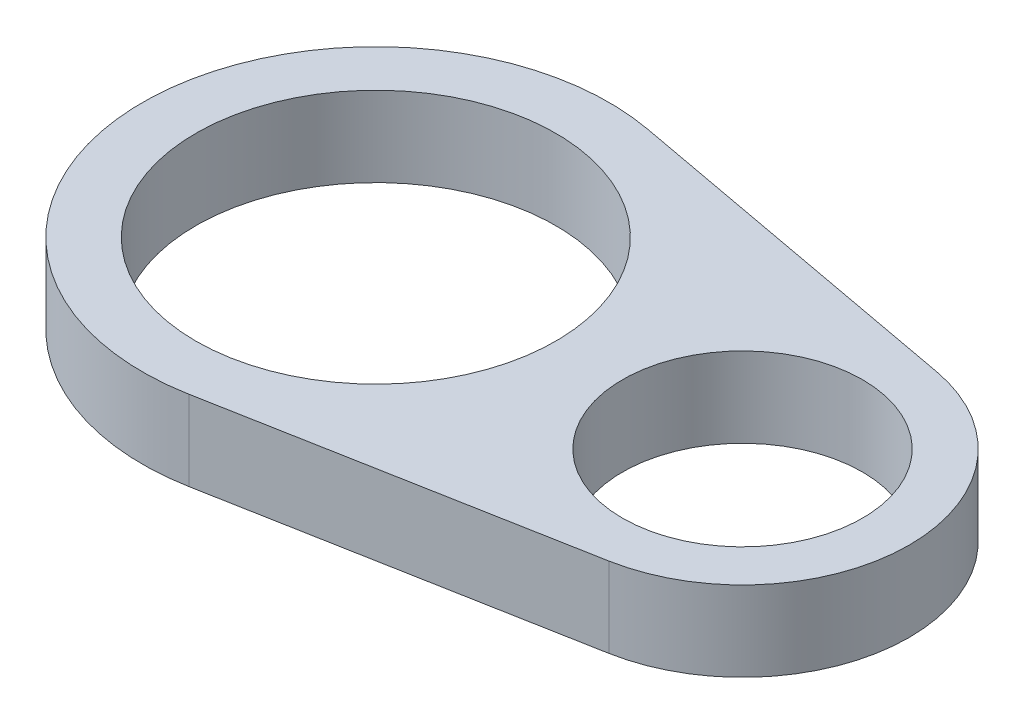
from build123d import *

# Parameters (mm, degrees)
SKETCH_1_R      = 35
SKETCH_1_R_2    = 27
EXTRUDE_1_DEPTH = 12
SKETCH_2_R      = 18
EXTRUDE_2_DEPTH = 12


with BuildPart() as part:
    # 草图1 → 凸台-拉伸1 (new body)
    with BuildSketch(Plane(origin=(0, 0, 0), x_dir=(1, 0, 0), z_dir=(0, 1, 0))):
        with Locations(Location((0, 0, 0), (0, 0, 270))):
            Circle(SKETCH_1_R)
        with Locations(Location((0, 0, 0), (0, 0, 270))):
            Circle(SKETCH_1_R_2, mode=Mode.SUBTRACT)
    extrude(amount=EXTRUDE_1_DEPTH)

    # 草图2 → 凸台-拉伸2 (add)
    with BuildSketch(Plane.XZ):
        with BuildLine():
            Line((6.363636364, 34.416625811), (59.545454545, 24.583304151))
            ThreePointArc((59.545454545, 24.583304151), (80, 0), (59.545454545, -24.583304151))
            Line((59.545454545, -24.583304151), (6.363636364, -34.416625811))
            ThreePointArc((6.363636364, -34.416625811), (35, 0), (6.363636364, 34.416625811))
        make_face()
        with Locations(Location((55, 0, 0), (0, 0, 270))):
            Circle(SKETCH_2_R, mode=Mode.SUBTRACT)
    extrude(amount=-EXTRUDE_2_DEPTH)


solid = part.part
